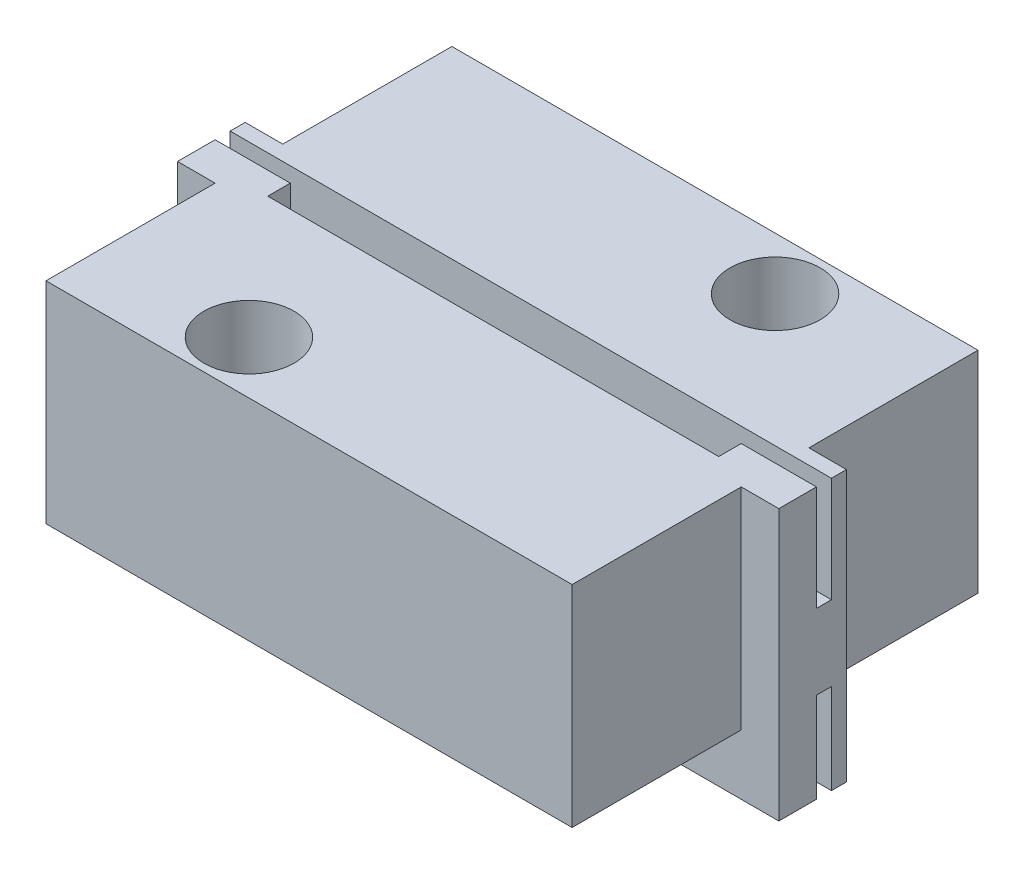
from build123d import *

# Parameters (mm, degrees)
SKETCH1_W           = 35
SKETCH1_H           = 27
BOSS_EXTRUDE1_DEPTH = 14
SKETCH2_R           = 1.75
CUT_EXTRUDE1_DEPTH  = 14
SKETCH9_R           = 3
CUT_EXTRUDE7_DEPTH  = 10
SKETCH10_W          = 35
SKETCH10_H          = 4.5
BOSS_EXTRUDE2_DEPTH = 4
SKETCH11_W          = 35
SKETCH11_H          = 2.5
CUT_EXTRUDE8_DEPTH  = 6
BOSS_EXTRUDE3_DEPTH = 2.5
BOSS_EXTRUDE4_DEPTH = 2.5
SKETCH14_W          = 5
SKETCH14_H          = 6
BOSS_EXTRUDE5_DEPTH = 1.5
SKETCH15_W          = 40
SKETCH15_H          = 2.5
CUT_EXTRUDE9_DEPTH  = 7
SKETCH16_W          = 5
SKETCH16_H          = 7
BOSS_EXTRUDE6_DEPTH = 1.5


with BuildPart() as part:
    # Sketch1 → Boss-Extrude1 (new body)
    with BuildSketch(Plane(origin=(0, 0, 0), x_dir=(1, 0, 0), z_dir=(0, 1, 0))):
        Rectangle(SKETCH1_W, SKETCH1_H)
    extrude(amount=BOSS_EXTRUDE1_DEPTH)

    # Sketch2 → Cut-Extrude1 (cut)
    with BuildSketch(Plane(origin=(0, 14, 0), x_dir=(1, 0, 0), z_dir=(0, 1, 0))):
        with Locations(Location((7.5, 10, 0), (0, 0, 270))):
            Circle(SKETCH2_R)
        with Locations(Location((-7.5, -10, 0), (0, 0, 270))):
            Circle(SKETCH2_R)
    extrude(amount=-CUT_EXTRUDE1_DEPTH, mode=Mode.SUBTRACT)

    # Sketch9 → Cut-Extrude7 (cut)
    with BuildSketch(Plane(origin=(0, 14, 0), x_dir=(1, 0, 0), z_dir=(0, 1, 0))):
        with Locations(Location((7.5, 10, 0), (0, 0, 270))):
            Circle(SKETCH9_R)
        with Locations(Location((-7.5, -10, 0), (0, 0, 270))):
            Circle(SKETCH9_R)
    extrude(amount=-CUT_EXTRUDE7_DEPTH, mode=Mode.SUBTRACT)

    # Sketch10 → Boss-Extrude2 (add)
    with BuildSketch(Plane.XZ):
        Rectangle(SKETCH10_W, SKETCH10_H)
    extrude(amount=BOSS_EXTRUDE2_DEPTH)

    # Sketch11 → Cut-Extrude8 (cut)
    with BuildSketch(Plane.XZ.offset(4)):
        Rectangle(SKETCH11_W, SKETCH11_H)
    extrude(amount=-CUT_EXTRUDE8_DEPTH, mode=Mode.SUBTRACT)

    # Sketch12 → Boss-Extrude3 (add)
    with BuildSketch(Plane.ZY.offset(17.5)):
        Polygon((-2.25, -4), (-2.25, 0), (-2.25, 14), (2.25, 14), (2.25, 0), (2.25, -4), (1.25, -4), (1.25, 2), (-1.25, 2), (-1.25, -4), align=None)
    extrude(amount=BOSS_EXTRUDE3_DEPTH)

    # Sketch13 → Boss-Extrude4 (add)
    with BuildSketch(Plane(origin=(17.5, 0, 0), x_dir=(0, 0, -1), z_dir=(1, 0, 0))):
        Polygon((2.25, -4), (2.25, 0), (2.25, 14), (-2.25, 14), (-2.25, 0), (-2.25, -4), (-1.25, -4), (-1.25, 2), (1.25, 2), (1.25, -4), align=None)
    extrude(amount=BOSS_EXTRUDE4_DEPTH)

    # Sketch14 → Boss-Extrude5 (add)
    with BuildSketch(Plane(origin=(0, 0, 1.25), x_dir=(-1, 0, 0), z_dir=(0, 0, -1))):
        with Locations((-17.5, -1)):
            Rectangle(SKETCH14_W, SKETCH14_H)
        with Locations((17.5, -1)):
            Rectangle(SKETCH14_W, SKETCH14_H)
    extrude(amount=BOSS_EXTRUDE5_DEPTH)

    # Sketch15 → Cut-Extrude9 (cut)
    with BuildSketch(Plane(origin=(0, 14, 0), x_dir=(1, 0, 0), z_dir=(0, 1, 0))):
        Rectangle(SKETCH15_W, SKETCH15_H)
    extrude(amount=-CUT_EXTRUDE9_DEPTH, mode=Mode.SUBTRACT)

    # Sketch16 → Boss-Extrude6 (add)
    with BuildSketch(Plane(origin=(0, 0, 1.25), x_dir=(-1, 0, 0), z_dir=(0, 0, -1))):
        with Locations((-17.5, 10.5)):
            Rectangle(SKETCH16_W, SKETCH16_H)
        with Locations((17.5, 10.5)):
            Rectangle(SKETCH16_W, SKETCH16_H)
    extrude(amount=BOSS_EXTRUDE6_DEPTH)


solid = part.part
